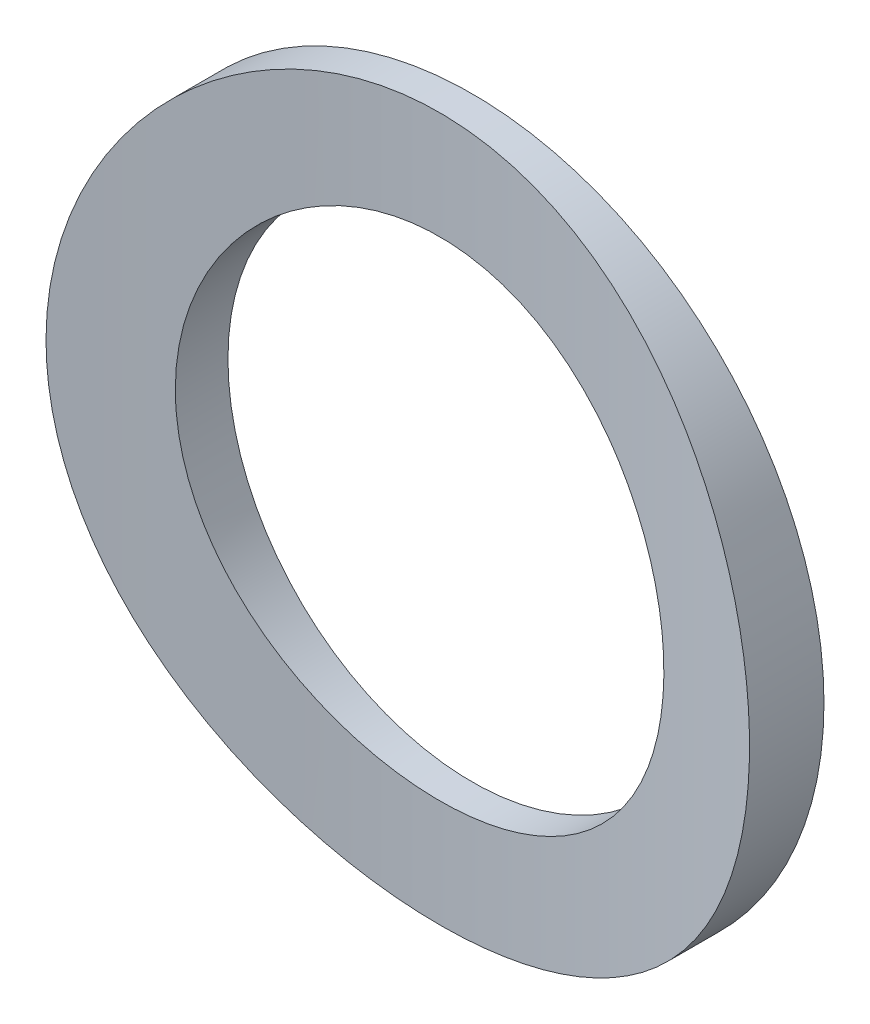
from build123d import *

# Parameters (mm, degrees)
SKETCH1_R               = 10.8
SKETCH1_R_2             = 7.5
BOSS_EXTRUDE1_DEPTH     = 30
CUT_EXTRUDE1_DEPTH      = 34.664224334
CUT_EXTRUDE1_DEPTH_BACK = 34.664224334
SKETCH2_R               = 46


with BuildPart() as part:
    # Sketch1 → Boss-Extrude1 (new body)
    with BuildSketch(Plane.XY):
        Circle(SKETCH1_R)
        Circle(SKETCH1_R_2, mode=Mode.SUBTRACT)
    extrude(amount=BOSS_EXTRUDE1_DEPTH)

    # Sketch2 → Cut-Extrude1 (cut, two sides: drawn at the far end of the back side and taken through both)
    with BuildSketch(Plane(origin=(0, 0, 0), x_dir=(1, 0, 0), z_dir=(0, 1, 0)).offset(-CUT_EXTRUDE1_DEPTH_BACK)):
        with Locations((0, -47)):
            Circle(SKETCH2_R)
    extrude(amount=CUT_EXTRUDE1_DEPTH + CUT_EXTRUDE1_DEPTH_BACK, mode=Mode.SUBTRACT)


solid = part.part
